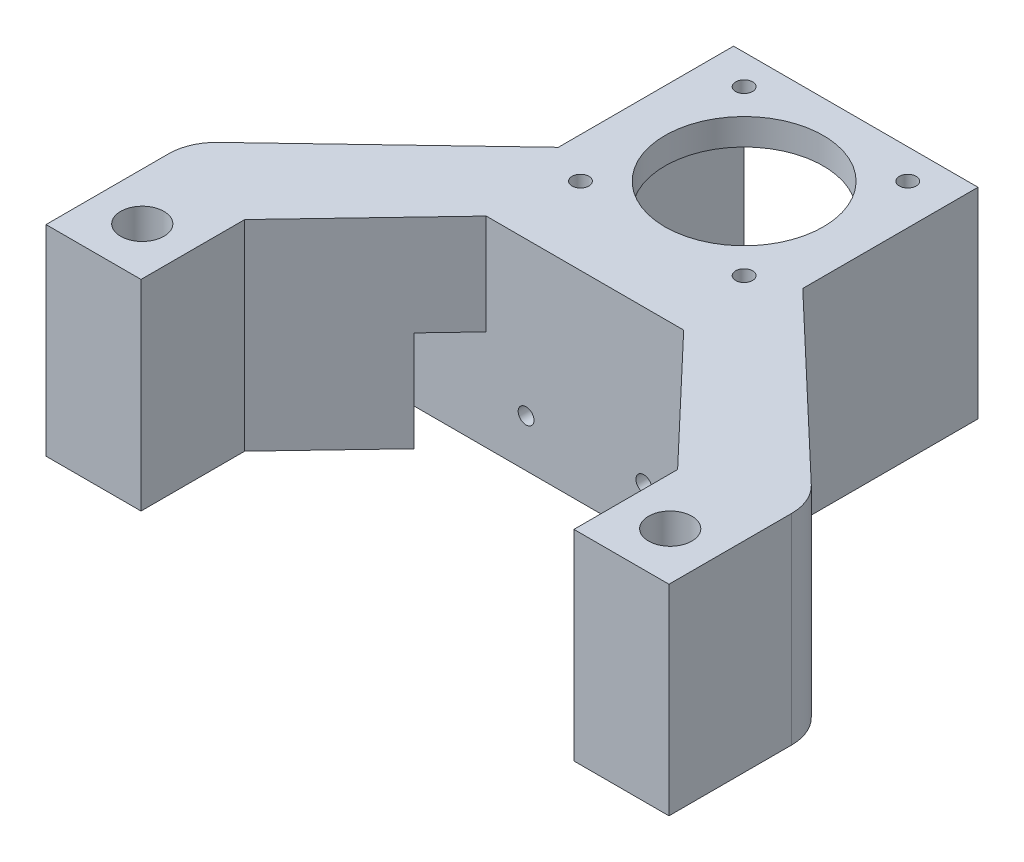
from build123d import *

# Parameters (mm, degrees)
SKETCH_6_W          = 42.3
SKETCH_6_H          = 42.3
SKETCH_6_R          = 1.6
SKETCH_6_R_2        = 15
EXTRUDE_1_DEPTH     = 5
SKETCH_7_R          = 4.1
EXTRUDE_5_DEPTH     = 38
EXTRUDE_START       = 38
SKETCH_7_7_R        = 4.1
EXTRUDE_7_DEPTH     = 38
SKETCH_7_8_R        = 4.1
EXTRUDE_8_DEPTH     = 38
SKETCH_12_W         = 2
SKETCH_12_H         = 44.3
EXTRUDE_11_DEPTH    = 38
SKETCH_14_W         = 44.3
SKETCH_14_H         = 2
EXTRUDE_12_DEPTH    = 38
SKETCH_15_W         = 2
SKETCH_15_H         = 42.3
EXTRUDE_13_DEPTH    = 38
SKETCH_17_W         = 122.95750499
SKETCH_17_H         = 7
CUT_EXTRUDE_1_DEPTH = 19
EXTRUDE_14_DEPTH    = 38
CUT_EXTRUDE_3_DEPTH = 3
SKETCH_22_R         = 1.5
CUT_EXTRUDE_4_DEPTH = 10


with BuildPart() as part:
    # 草图6 → 凸台-拉伸1 (new body)
    with BuildSketch(Plane(origin=(0, 0, 0), x_dir=(1, 0, 0), z_dir=(0, 1, 0))):
        Rectangle(SKETCH_6_W, SKETCH_6_H)
        with Locations(Location((15.5, 15.5, 0), (0, 0, 270))):
            Circle(SKETCH_6_R, mode=Mode.SUBTRACT)
        with Locations(Location((-15.5, 15.5, 0), (0, 0, 270))):
            Circle(SKETCH_6_R, mode=Mode.SUBTRACT)
        with Locations(Location((-15.5, -15.5, 0), (0, 0, 270))):
            Circle(SKETCH_6_R, mode=Mode.SUBTRACT)
        with Locations(Location((15.5, -15.5, 0), (0, 0, 270))):
            Circle(SKETCH_6_R, mode=Mode.SUBTRACT)
        with Locations(Location((0, 0, 0), (0, 0, 270))):
            Circle(SKETCH_6_R_2, mode=Mode.SUBTRACT)
    extrude(amount=EXTRUDE_1_DEPTH)

    # 草图7 → 凸台-拉伸5 (add)
    # profile 1 of 2: a face of its own
    with BuildSketch(Plane(origin=(0, 5, 0), x_dir=(1, 0, 0), z_dir=(0, 1, 0))):
        with BuildLine():
            Line((-41, -53.596295528), (-10.142654247, -21.15))
            Line((-10.142654247, -21.15), (-21.15, -21.15))
            Line((-21.15, -21.15), (-21.15, -10.142654247))
            Line((-21.15, -10.142654247), (-56.202269248, -43.478354795))
            ThreePointArc((-56.202269248, -43.478354795), (-58.271046585, -46.45179082), (-59, -50))
            Line((-59, -50), (-59, -73.238133914))
            Line((-59, -73.238133914), (-41, -73.238133914))
            Line((-41, -73.238133914), (-41, -53.596295528))
        make_face()
        with Locations(Location((-50, -64, 0), (0, 0, 270))):
            Circle(SKETCH_7_R, mode=Mode.SUBTRACT)
    # profile 2 of 2: a face of its own
    with BuildSketch(Plane(origin=(0, 5, 0), x_dir=(1, 0, 0), z_dir=(0, 1, 0))):
        with BuildLine():
            Line((21.15, -21.15), (10.142654247, -21.15))
            Line((10.142654247, -21.15), (41, -53.596295528))
            Line((41, -53.596295528), (41, -73.238133914))
            Line((41, -73.238133914), (59, -73.238133914))
            Line((59, -73.238133914), (59, -50))
            ThreePointArc((59, -50), (58.271046585, -46.45179082), (56.202269248, -43.478354795))
            Line((56.202269248, -43.478354795), (21.15, -10.142654247))
            Line((21.15, -10.142654247), (21.15, -21.15))
        make_face()
        with Locations(Location((50, -64, 0), (0, 0, 270))):
            Circle(SKETCH_7_R, mode=Mode.SUBTRACT)
    extrude(amount=-EXTRUDE_5_DEPTH)

    # 草图7<7> → 凸台-拉伸7 (add)
    with BuildSketch(Plane(origin=(0, 5, 0), x_dir=(1, 0, 0), z_dir=(0, 1, 0)).offset(EXTRUDE_START)):
        with Locations(Location((-50, -64, 0), (0, 0, 270))):
            Circle(SKETCH_7_7_R)
        with Locations(Location((50, -64, 0), (0, 0, 270))):
            Circle(SKETCH_7_7_R)
    extrude(amount=-EXTRUDE_7_DEPTH)


with BuildPart() as extrude_7_kept_piece:
    # of the separate pieces the step leaves, the one the design keeps (extrude_7_pieces_kept)
    add(part.part.solids().sort_by_distance((-10.142654247, 0, 21.15))[0])

    # 草图7<8> → 凸台-拉伸8 (add)
    with BuildSketch(Plane(origin=(0, 5, 0), x_dir=(1, 0, 0), z_dir=(0, 1, 0))):
        with Locations(Location((-50, -64, 0), (0, 0, 270))):
            Circle(SKETCH_7_8_R)
        with Locations(Location((50, -64, 0), (0, 0, 270))):
            Circle(SKETCH_7_8_R)
    extrude(amount=EXTRUDE_8_DEPTH)


with BuildPart() as extrude_8_kept_piece:
    # of the separate pieces the step leaves, the one the design keeps (extrude_8_pieces_kept)
    add(extrude_7_kept_piece.part.solids().sort_by_distance((-10.142654247, 0, 21.15))[0])

    # 草图12 → 凸台-拉伸11 (add)
    with BuildSketch(Plane(origin=(0, 5, 0), x_dir=(1, 0, 0), z_dir=(0, 1, 0))):
        with Locations((22.15, -1)):
            Rectangle(SKETCH_12_W, SKETCH_12_H)
    extrude(amount=-EXTRUDE_11_DEPTH)

    # 草图14 → 凸台-拉伸12 (add)
    with BuildSketch(Plane(origin=(0, 5, 0), x_dir=(1, 0, 0), z_dir=(0, 1, 0))):
        with Locations((-1, -22.15)):
            Rectangle(SKETCH_14_W, SKETCH_14_H)
    extrude(amount=-EXTRUDE_12_DEPTH)

    # 草图15 → 凸台-拉伸13 (add)
    with BuildSketch(Plane(origin=(0, 5, 0), x_dir=(1, 0, 0), z_dir=(0, 1, 0))):
        with Locations((-22.15, 0)):
            Rectangle(SKETCH_15_W, SKETCH_15_H)
    extrude(amount=-EXTRUDE_13_DEPTH)

    # 草图17 → 切除-拉伸1 (cut)
    with BuildSketch(Plane.XZ.offset(33)):
        with Locations((-0.358433095, 33.65)):
            Rectangle(SKETCH_17_W, SKETCH_17_H)
    extrude(amount=-CUT_EXTRUDE_1_DEPTH, mode=Mode.SUBTRACT)

    # 草图21 → 凸台-拉伸14 (add)
    with BuildSketch(Plane.XZ.offset(33)):
        Polygon((18.701909079, 30.15), (-18.701909079, 30.15), (-12.044710877, 23.15), (12.044710877, 23.15), align=None)
    extrude(amount=-EXTRUDE_14_DEPTH)

    # 草图20 → 切除-拉伸3 (cut)
    with BuildSketch(Plane(origin=(0, 0, 21.15), x_dir=(-1, 0, 0), z_dir=(0, 0, -1))):
        Polygon((-7.75, -24), (-9.45, -21.055513627), (-12.85, -21.055513627), (-14.55, -24), (-12.85, -26.944486373), (-9.45, -26.944486373), align=None)
        Polygon((14.55, -24), (12.85, -21.055513627), (9.45, -21.055513627), (7.75, -24), (9.45, -26.944486373), (12.85, -26.944486373), align=None)
    extrude(amount=-CUT_EXTRUDE_3_DEPTH, mode=Mode.SUBTRACT)

    # 草图22 → 切除-拉伸4 (cut)
    with BuildSketch(Plane(origin=(0, 0, 21.15), x_dir=(-1, 0, 0), z_dir=(0, 0, -1))):
        with Locations((11.15, -24)):
            Circle(SKETCH_22_R)
        with Locations((-11.15, -24)):
            Circle(SKETCH_22_R)
    extrude(amount=-CUT_EXTRUDE_4_DEPTH, mode=Mode.SUBTRACT)


solid = extrude_8_kept_piece.part
